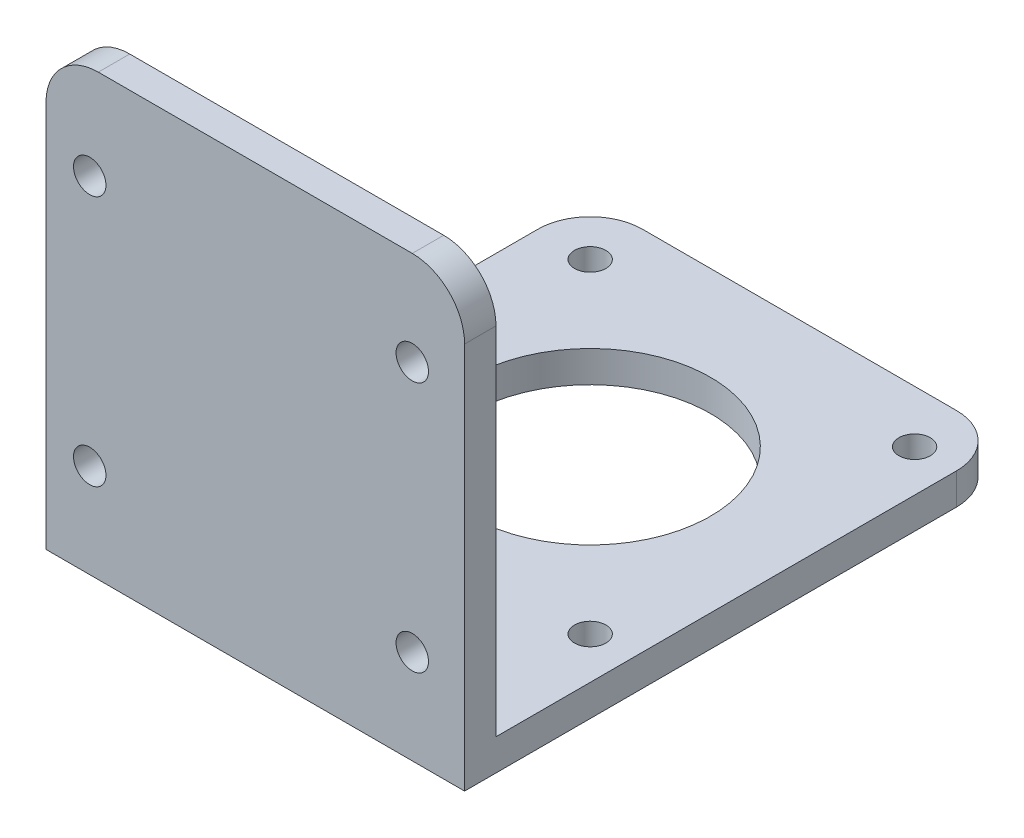
from build123d import *

# Parameters (mm, degrees)
EXTRUDE_1_DEPTH     = 3
SKETCH_3_W          = 40
SKETCH_3_H          = 3
EXTRUDE_2_DEPTH     = 39
CUT_EXTRUDE_1_REACH = 76.012
CUT_EXTRUDE_2_REACH = 59.234
SKETCH_5_R          = 1.5
SKETCH_5_R_2        = 11.5
CUT_EXTRUDE_3_REACH = 76.012
SKETCH_6_R          = 1.55


with BuildPart() as part:
    # 草图2 → 凸台-拉伸1 (new body)
    with BuildSketch(Plane(origin=(0, 0, 0), x_dir=(1, 0, 0), z_dir=(0, 1, 0))):
        with BuildLine():
            Line((-26.777777778, 24.707602339), (3.222222222, 24.707602339))
            ThreePointArc((3.222222222, 24.707602339), (6.757756128, 23.243136245), (8.222222222, 19.707602339))
            Line((8.222222222, 19.707602339), (8.222222222, -27.292397661))
            Line((8.222222222, -27.292397661), (-31.777777778, -27.292397661))
            Line((-31.777777778, -27.292397661), (-31.777777778, 19.707602339))
            ThreePointArc((-31.777777778, 19.707602339), (-30.313311684, 23.243136245), (-26.777777778, 24.707602339))
        make_face()
    extrude(amount=EXTRUDE_1_DEPTH)

    # 草图3 → 凸台-拉伸2 (add)
    with BuildSketch(Plane(origin=(0, 3, 0), x_dir=(1, 0, 0), z_dir=(0, 1, 0))):
        with Locations((-11.777777778, -25.792397661)):
            Rectangle(SKETCH_3_W, SKETCH_3_H)
    extrude(amount=EXTRUDE_2_DEPTH)

    # 草图4 → 切除-拉伸1 (cut, up to next)
    with BuildSketch(Plane.XY.offset(27.292397661), mode=Mode.PRIVATE) as cut_extrude_1_sk1:
        with BuildLine():
            Line((-31.777777778, 37), (-31.777777778, 42))
            Line((-31.777777778, 42), (-26.777777778, 42))
            ThreePointArc((-26.777777778, 42), (-30.313311684, 40.535533906), (-31.777777778, 37))
        make_face()
    cut_extrude_1_tool1 = extrude(cut_extrude_1_sk1.sketch, amount=-CUT_EXTRUDE_1_REACH, mode=Mode.PRIVATE) & part.part
    # 草图4 → 切除-拉伸1 (cut, up to next)
    with BuildSketch(Plane.XY.offset(27.292397661), mode=Mode.PRIVATE) as cut_extrude_1_sk2:
        with BuildLine():
            Line((3.222222222, 42), (8.222222222, 42))
            Line((8.222222222, 42), (8.222222222, 37))
            ThreePointArc((8.222222222, 37), (6.757756128, 40.535533906), (3.222222222, 42))
        make_face()
    cut_extrude_1_tool2 = extrude(cut_extrude_1_sk2.sketch, amount=-CUT_EXTRUDE_1_REACH, mode=Mode.PRIVATE) & part.part
    add(cut_extrude_1_tool1.solids().sort_by_distance((-30.660938, 40.88316, 27.292398))[0], mode=Mode.SUBTRACT)
    add(cut_extrude_1_tool2.solids().sort_by_distance((7.105383, 40.88316, 27.292398))[0], mode=Mode.SUBTRACT)

    # 草图5 → 切除-拉伸2 (cut, up to next)
    with BuildSketch(Plane(origin=(0, 3, 0), x_dir=(1, 0, 0), z_dir=(0, 1, 0)), mode=Mode.PRIVATE) as cut_extrude_2_sk1:
        with Locations(Location((-26.777777778, 19.707602339, 0), (0, 0, 270))):
            Circle(SKETCH_5_R)
    cut_extrude_2_tool1 = extrude(cut_extrude_2_sk1.sketch, amount=-CUT_EXTRUDE_2_REACH, mode=Mode.PRIVATE) & part.part
    # 草图5 → 切除-拉伸2 (cut, up to next)
    with BuildSketch(Plane(origin=(0, 3, 0), x_dir=(1, 0, 0), z_dir=(0, 1, 0)), mode=Mode.PRIVATE) as cut_extrude_2_sk2:
        with Locations(Location((4.222222222, 19.707602339, 0), (0, 0, 270))):
            Circle(SKETCH_5_R)
    cut_extrude_2_tool2 = extrude(cut_extrude_2_sk2.sketch, amount=-CUT_EXTRUDE_2_REACH, mode=Mode.PRIVATE) & part.part
    # 草图5 → 切除-拉伸2 (cut, up to next)
    with BuildSketch(Plane(origin=(0, 3, 0), x_dir=(1, 0, 0), z_dir=(0, 1, 0)), mode=Mode.PRIVATE) as cut_extrude_2_sk3:
        with Locations(Location((-26.777777778, -11.292397661, 0), (0, 0, 270))):
            Circle(SKETCH_5_R)
    cut_extrude_2_tool3 = extrude(cut_extrude_2_sk3.sketch, amount=-CUT_EXTRUDE_2_REACH, mode=Mode.PRIVATE) & part.part
    # 草图5 → 切除-拉伸2 (cut, up to next)
    with BuildSketch(Plane(origin=(0, 3, 0), x_dir=(1, 0, 0), z_dir=(0, 1, 0)), mode=Mode.PRIVATE) as cut_extrude_2_sk4:
        with Locations(Location((4.222222222, -11.292397661, 0), (0, 0, 270))):
            Circle(SKETCH_5_R)
    cut_extrude_2_tool4 = extrude(cut_extrude_2_sk4.sketch, amount=-CUT_EXTRUDE_2_REACH, mode=Mode.PRIVATE) & part.part
    # 草图5 → 切除-拉伸2 (cut, up to next)
    with BuildSketch(Plane(origin=(0, 3, 0), x_dir=(1, 0, 0), z_dir=(0, 1, 0)), mode=Mode.PRIVATE) as cut_extrude_2_sk5:
        with Locations(Location((-11.277777778, 4.207602339, 0), (0, 0, 270))):
            Circle(SKETCH_5_R_2)
    cut_extrude_2_tool5 = extrude(cut_extrude_2_sk5.sketch, amount=-CUT_EXTRUDE_2_REACH, mode=Mode.PRIVATE) & part.part
    add(cut_extrude_2_tool1.solids().sort_by_distance((-26.777778, 3, -19.707602))[0], mode=Mode.SUBTRACT)
    add(cut_extrude_2_tool2.solids().sort_by_distance((4.222222, 3, -19.707602))[0], mode=Mode.SUBTRACT)
    add(cut_extrude_2_tool3.solids().sort_by_distance((-26.777778, 3, 11.292398))[0], mode=Mode.SUBTRACT)
    add(cut_extrude_2_tool4.solids().sort_by_distance((4.222222, 3, 11.292398))[0], mode=Mode.SUBTRACT)
    add(cut_extrude_2_tool5.solids().sort_by_distance((-11.277778, 3, -4.207602))[0], mode=Mode.SUBTRACT)

    # 草图6 → 切除-拉伸3 (cut, up to next)
    with BuildSketch(Plane.XY.offset(27.292397661), mode=Mode.PRIVATE) as cut_extrude_3_sk1:
        with Locations((-27.59761171, 9)):
            Circle(SKETCH_6_R)
    cut_extrude_3_tool1 = extrude(cut_extrude_3_sk1.sketch, amount=-CUT_EXTRUDE_3_REACH, mode=Mode.PRIVATE) & part.part
    # 草图6 → 切除-拉伸3 (cut, up to next)
    with BuildSketch(Plane.XY.offset(27.292397661), mode=Mode.PRIVATE) as cut_extrude_3_sk2:
        with Locations((-27.59761171, 33)):
            Circle(SKETCH_6_R)
    cut_extrude_3_tool2 = extrude(cut_extrude_3_sk2.sketch, amount=-CUT_EXTRUDE_3_REACH, mode=Mode.PRIVATE) & part.part
    # 草图6 → 切除-拉伸3 (cut, up to next)
    with BuildSketch(Plane.XY.offset(27.292397661), mode=Mode.PRIVATE) as cut_extrude_3_sk3:
        with Locations((3.222222222, 9)):
            Circle(SKETCH_6_R)
    cut_extrude_3_tool3 = extrude(cut_extrude_3_sk3.sketch, amount=-CUT_EXTRUDE_3_REACH, mode=Mode.PRIVATE) & part.part
    # 草图6 → 切除-拉伸3 (cut, up to next)
    with BuildSketch(Plane.XY.offset(27.292397661), mode=Mode.PRIVATE) as cut_extrude_3_sk4:
        with Locations((3.222222222, 33)):
            Circle(SKETCH_6_R)
    cut_extrude_3_tool4 = extrude(cut_extrude_3_sk4.sketch, amount=-CUT_EXTRUDE_3_REACH, mode=Mode.PRIVATE) & part.part
    add(cut_extrude_3_tool1.solids().sort_by_distance((-27.597612, 9, 27.292398))[0], mode=Mode.SUBTRACT)
    add(cut_extrude_3_tool2.solids().sort_by_distance((-27.597612, 33, 27.292398))[0], mode=Mode.SUBTRACT)
    add(cut_extrude_3_tool3.solids().sort_by_distance((3.222222, 9, 27.292398))[0], mode=Mode.SUBTRACT)
    add(cut_extrude_3_tool4.solids().sort_by_distance((3.222222, 33, 27.292398))[0], mode=Mode.SUBTRACT)


solid = part.part
